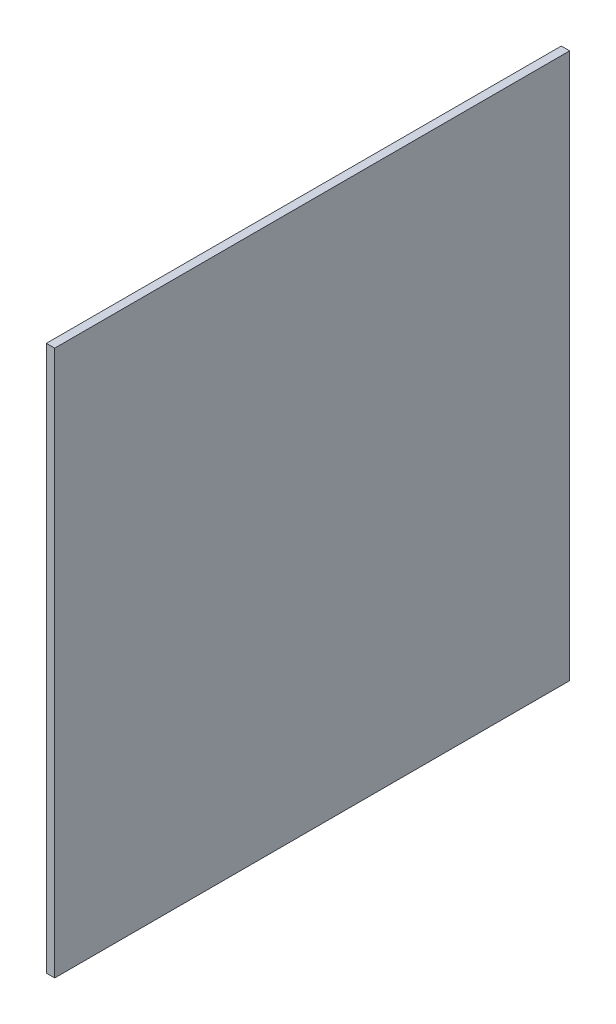
from build123d import *

# Parameters (mm, degrees)
SKETCH_1_W      = 246.313610761
SKETCH_1_H      = 260.901962248
EXTRUDE_1_DEPTH = 4


with BuildPart() as part:
    # Эскиз1 → Вытянуть1 (new body)
    with BuildSketch(Plane(origin=(0, 0, 0), x_dir=(0, 0, -1), z_dir=(1, 0, 0))):
        with Locations((-65.230332586, -130.450981124)):
            Rectangle(SKETCH_1_W, SKETCH_1_H)
    extrude(amount=EXTRUDE_1_DEPTH)


solid = part.part
